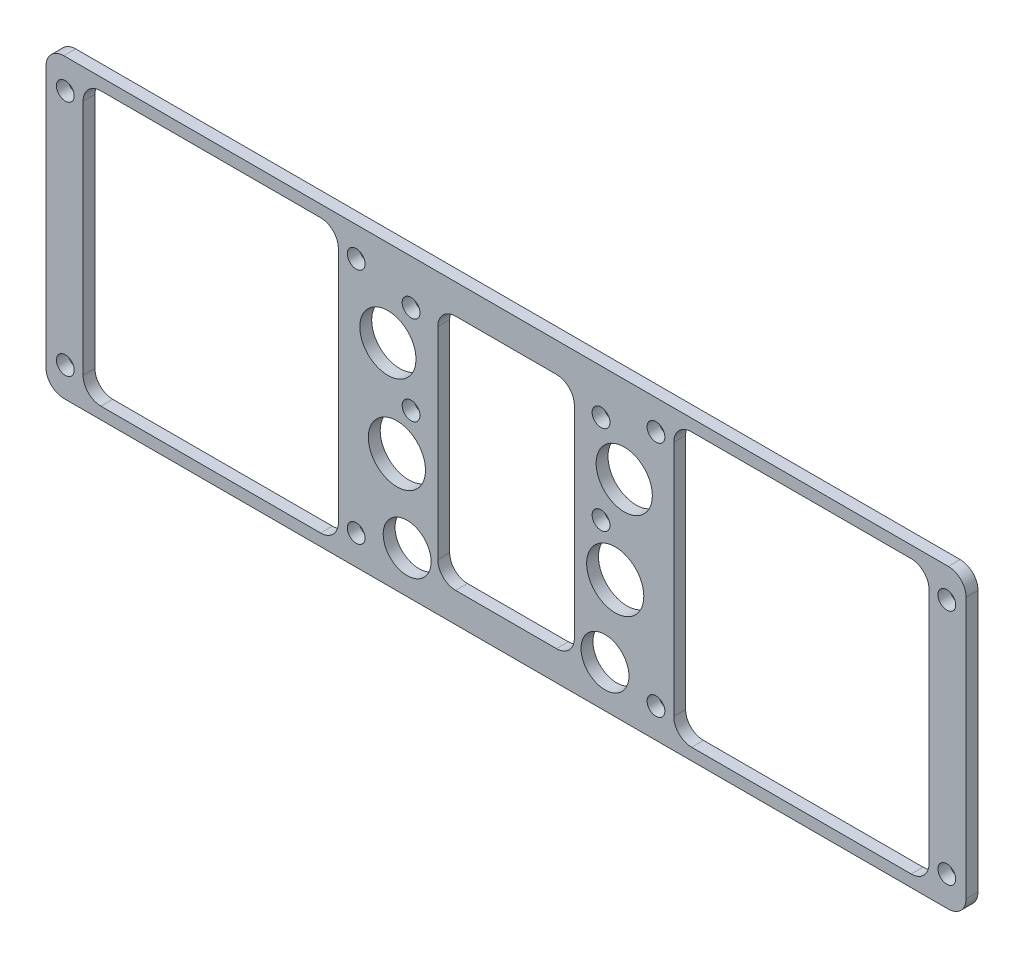
from build123d import *

# Parameters (mm, degrees)
SKETCH_1_W          = 155
SKETCH_1_H          = 50
EXTRUDE_1_DEPTH     = 2
SKETCH_2_R          = 1.5
CUT_EXTRUDE_1_DEPTH = 10
FILLET_1_R          = 3
SKETCH_3_W          = 43
SKETCH_3_H          = 46
CUT_EXTRUDE_2_DEPTH = 10
FILLET_2_R          = 3
SKETCH_4_W          = 23
SKETCH_4_H          = 40
CUT_EXTRUDE_3_DEPTH = 10
FILLET_3_R          = 3
SKETCH_5_R          = 4.732430395
SKETCH_5_R_2        = 4.815282463
SKETCH_5_R_3        = 4.035251629
CUT_EXTRUDE_4_DEPTH = 10


with BuildPart() as part:
    # 草图1 → 凸台-拉伸1 (new body)
    with BuildSketch(Plane.XY):
        Rectangle(SKETCH_1_W, SKETCH_1_H)
    extrude(amount=EXTRUDE_1_DEPTH)

    # 草图2 → 切除-拉伸1 (cut)
    with BuildSketch(Plane(origin=(0, 0, 0), x_dir=(-1, 0, 0), z_dir=(0, 0, -1))):
        with Locations((-25.25, -20)):
            Circle(SKETCH_2_R)
        with Locations((-74.25, -20)):
            Circle(SKETCH_2_R)
        with Locations((-25.25, 20)):
            Circle(SKETCH_2_R)
        with Locations((-74.25, 20)):
            Circle(SKETCH_2_R)
        with Locations((25.25, -20)):
            Circle(SKETCH_2_R)
        with Locations((74.25, -20)):
            Circle(SKETCH_2_R)
        with Locations((25.25, 20)):
            Circle(SKETCH_2_R)
        with Locations((74.25, 20)):
            Circle(SKETCH_2_R)
        with Locations((16, 2.5)):
            Circle(SKETCH_2_R)
        with Locations((16, 17.5)):
            Circle(SKETCH_2_R)
        with Locations((-16, 2.5)):
            Circle(SKETCH_2_R)
        with Locations((-16, 17.5)):
            Circle(SKETCH_2_R)
    extrude(amount=-CUT_EXTRUDE_1_DEPTH, mode=Mode.SUBTRACT)

    # 圆角1
    fillet_1_edges = [part.edges().sort_by_distance(p)[0] for p in [
        (77.5, -25, 1),
        (-77.5, -25, 1),
        (-77.5, 25, 1),
        (77.5, 25, 1),
    ]]
    fillet(fillet_1_edges, radius=FILLET_1_R)

    # 草图3 → 切除-拉伸2 (cut)
    with BuildSketch(Plane.XY.offset(2)):
        with Locations((49.75, 0)):
            Rectangle(SKETCH_3_W, SKETCH_3_H)
        with Locations((-49.75, 0)):
            Rectangle(SKETCH_3_W, SKETCH_3_H)
    extrude(amount=-CUT_EXTRUDE_2_DEPTH, mode=Mode.SUBTRACT)

    # 圆角2
    fillet_2_edges = [part.edges().sort_by_distance(p)[0] for p in [
        (71.25, 23, 1),
        (71.25, -23, 1),
        (28.25, -23, 1),
        (28.25, 23, 1),
        (-28.25, 23, 1),
        (-28.25, -23, 1),
        (-71.25, -23, 1),
        (-71.25, 23, 1),
    ]]
    fillet(fillet_2_edges, radius=FILLET_2_R)

    # 草图4 → 切除-拉伸3 (cut)
    with BuildSketch(Plane.XY.offset(2)):
        Rectangle(SKETCH_4_W, SKETCH_4_H)
    extrude(amount=-CUT_EXTRUDE_3_DEPTH, mode=Mode.SUBTRACT)

    # 圆角3
    fillet_3_edges = [part.edges().sort_by_distance(p)[0] for p in [
        (11.5, 20, 1),
        (11.5, -20, 1),
        (-11.5, -20, 1),
        (-11.5, 20, 1),
    ]]
    fillet(fillet_3_edges, radius=FILLET_3_R)

    # 草图5 → 切除-拉伸4 (cut)
    with BuildSketch(Plane.XY.offset(2)):
        with Locations((19.907240007, 10.387913302)):
            Circle(SKETCH_5_R)
        with Locations((18.386877163, -5.018430181)):
            Circle(SKETCH_5_R_2)
        with Locations((16.663799274, -17.890835592)):
            Circle(SKETCH_5_R_3)
        with Locations(Location((-16.663799274, -17.890835592, 0), (0, 0, 180))):
            Circle(SKETCH_5_R_3)
        with Locations(Location((-18.386877163, -5.018430181, 0), (0, 0, 180))):
            Circle(SKETCH_5_R_2)
        with Locations(Location((-19.907240007, 10.387913302, 0), (0, 0, 180))):
            Circle(SKETCH_5_R)
    extrude(amount=-CUT_EXTRUDE_4_DEPTH, mode=Mode.SUBTRACT)


solid = part.part
